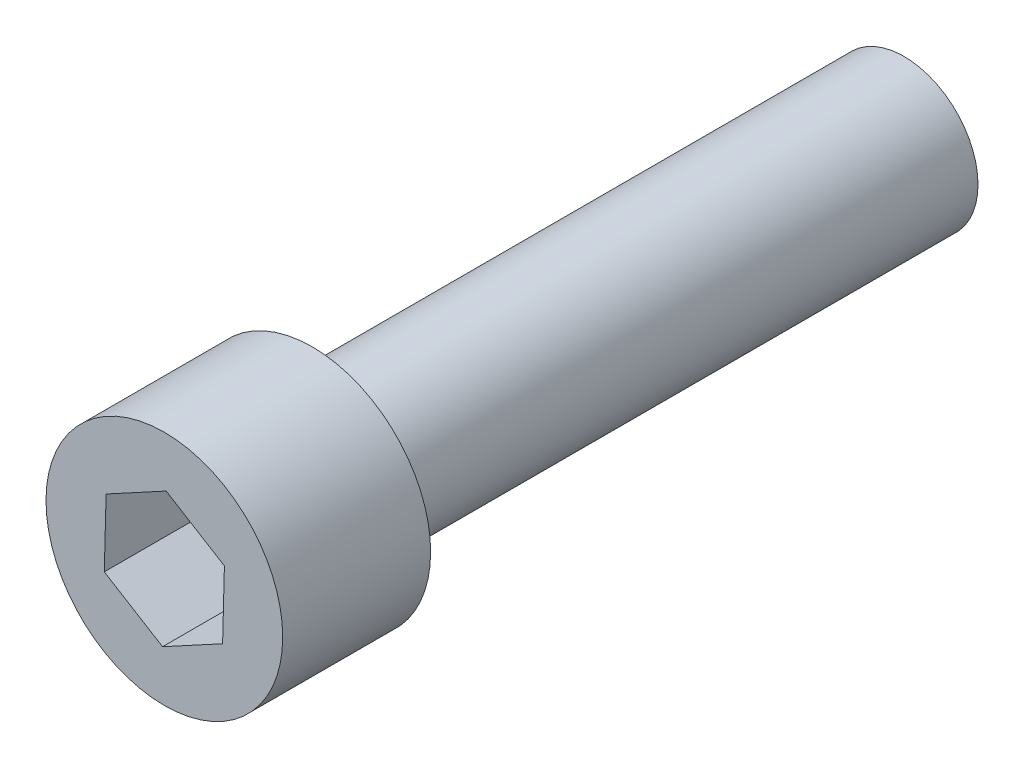
from build123d import *

# Parameters (mm, degrees)
SKETCH_1_R          = 2.5
EXTRUDE_1_DEPTH     = 20
SKETCH_2_R          = 4
EXTRUDE_2_DEPTH     = 5
CUT_EXTRUDE_1_DEPTH = 5


with BuildPart() as part:
    # 草图1 → 凸台-拉伸1 (new body)
    with BuildSketch(Plane.XY):
        Circle(SKETCH_1_R)
    extrude(amount=EXTRUDE_1_DEPTH)

    # 草图2 → 凸台-拉伸2 (add)
    with BuildSketch(Plane.XY.offset(20)):
        Circle(SKETCH_2_R)
    extrude(amount=EXTRUDE_2_DEPTH)

    # 草图3 → 切除-拉伸1 (cut)
    with BuildSketch(Plane.XY.offset(25)):
        Polygon((1.968923103, -1.20692798), (2.029691842, 1.101673436), (0.060768739, 2.308601415), (-1.968923103, 1.20692798), (-2.029691842, -1.101673436), (-0.060768739, -2.308601415), align=None)
    extrude(amount=-CUT_EXTRUDE_1_DEPTH, mode=Mode.SUBTRACT)


solid = part.part
